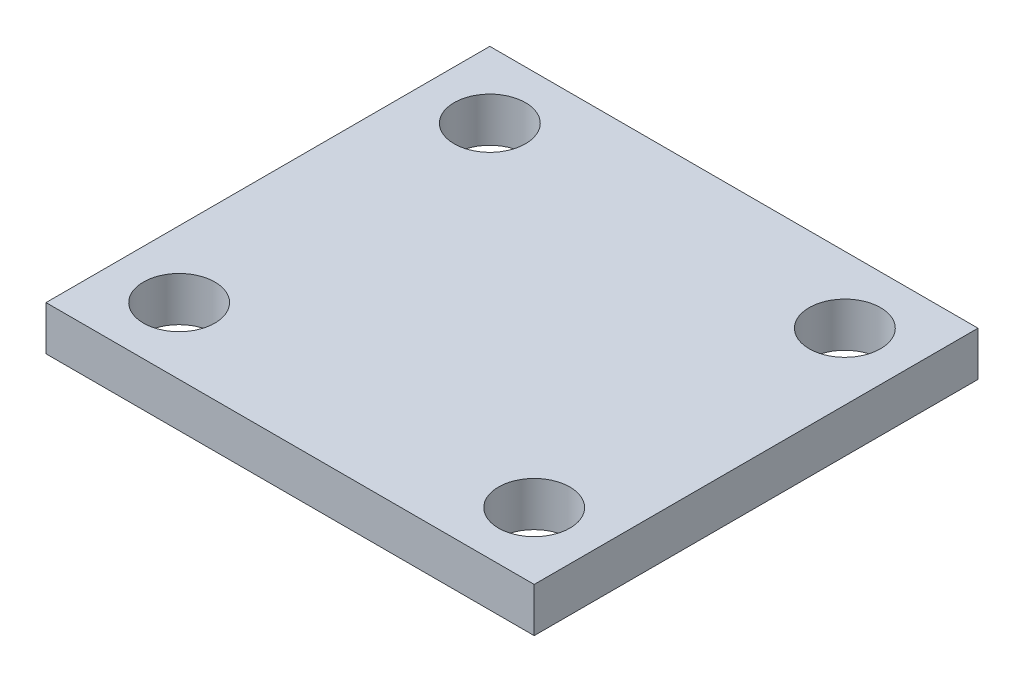
from build123d import *

# Parameters (mm, degrees)
SKETCH1_W              = 34.925
SKETCH1_H              = 31.75
PLATE_DEPTH            = 1.5875
F_10_CLEARANCE_HOLE1_D = 5.1054


with BuildPart() as part:
    # Sketch1 → Plate (new, symmetric)
    with BuildSketch(Plane(origin=(0, 0, 0), x_dir=(1, 0, 0), z_dir=(0, 1, 0))):
        Rectangle(SKETCH1_W, SKETCH1_H)
    extrude(amount=PLATE_DEPTH, both=True)

    # #10 Clearance Hole1 (through all)
    with Locations(Plane(origin=(0, 1.5875, 0), x_dir=(1, 0, 0), z_dir=(0, 1, 0))):
        with Locations((-12.7, 11.1125), (12.7, 11.1125), (12.7, -11.1125), (-12.7, -11.1125)):
            Hole(F_10_CLEARANCE_HOLE1_D / 2)


solid = part.part
